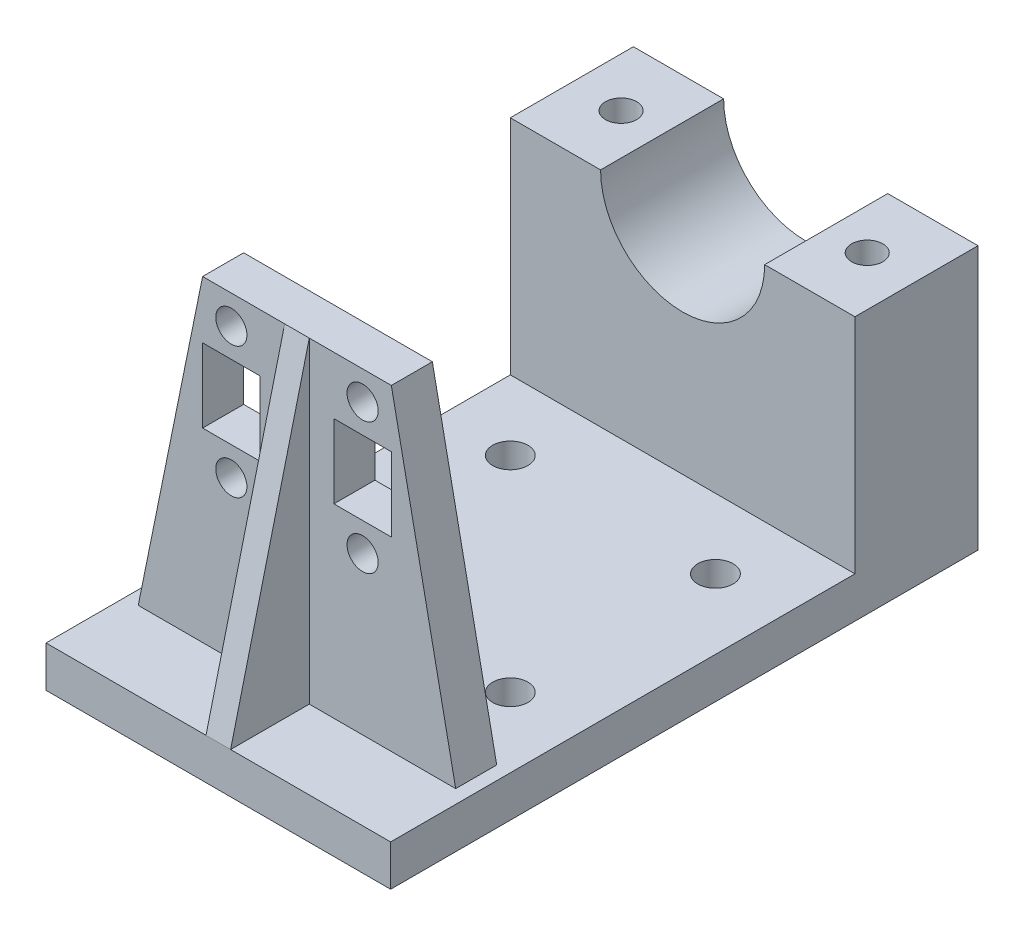
from build123d import *

# Parameters (mm, degrees)
MOTOR_MOUNT_SOLID_DEPTH              = 7.5
ENCODER_DISTANCE_SKETCH_W            = 50
ENCODER_DISTANCE_SKETCH_H            = 57
ENCODER_DISTANCE_SOLID_DEPTH         = 5
ENCODER_MOUNT_SKETCH_R               = 1.9
ENCODER_MOUNT_SKETCH_W               = 7
ENCODER_MOUNT_SKETCH_H               = 9
ENCODER_MOUNT_SOLID_DEPTH            = 5
MOTOR_CLAMP_MOUNTING_HOLES_SKETCH_R  = 1.9
MOTOR_CLAMP_MOUNTING_HOLES_CUT_DEPTH = 16
GUSSET_PLATE_SKETCH_W                = 50
GUSSET_PLATE_SKETCH_H                = 5
GUSSET_PLATE_SOLID_DEPTH             = 16.5
GUSSET_SOLID_DEPTH                   = 1.5
MOUNTING_PLATE_SKETCH_W              = 50
MOUNTING_PLATE_SKETCH_H              = 92
MOUNTING_PLATE_SKETCH_R              = 2.65
MOUNTING_PLATE_SOLID_DEPTH           = 5
MOUNTING_HOLES_CUT_DEPTH             = 101.440280764
MOUNTING_HOLES_CUT_DEPTH_BACK        = 101.440280764
MOUNTING_HOLE_SKETCH_R               = 2.65
MOUNTING_PLATE_TRIM_SKETCH_W         = 50
MOUNTING_PLATE_TRIM_SKETCH_H         = 13.5
MOUNTING_PLATE_TRIM_SKETCH_H_2       = 42
MOUNTING_PLATE_TRIM_SKETCH_W_2       = 23.5
MOUNTING_PLATE_TRIM_SKETCH_H_3       = 16.5
MOUNTING_PLATE_TRIM_CUT_DEPTH        = 2
CUT_EXTRUDE1_DEPTH                   = 102.917859083
CUT_EXTRUDE1_DEPTH_BACK              = 102.917859083
SKETCH2_W                            = 50
SKETCH2_H                            = 120
SKETCH2_W_2                          = 42
SKETCH2_H_2                          = 54.272597004
SKETCH3_W                            = 42
SKETCH3_H                            = 71.586450004
BOSS_EXTRUDE1_DEPTH                  = 5
CUT_EXTRUDE2_DEPTH                   = 78.722819275
CUT_EXTRUDE2_DEPTH_BACK              = 78.722819275
SKETCH4_R                            = 2.15


with BuildPart() as part:
    # Mouting Mount Sketch → Motor Mount Solid (new, symmetric)
    with BuildSketch(Plane.XY):
        with BuildLine():
            Line((-25, -55), (25, -55))
            Line((25, -55), (25, 0))
            Line((25, 0), (10, 0))
            ThreePointArc((10, 0), (0, -10), (-10, 0))
            Line((-10, 0), (-25, 0))
            Line((-25, 0), (-25, -55))
        make_face()
    extrude(amount=MOTOR_MOUNT_SOLID_DEPTH, both=True)

    # Encoder Distance Sketch → Encoder Distance Solid (add)
    with BuildSketch(Plane.XZ.offset(55)):
        with Locations((0, 21)):
            Rectangle(ENCODER_DISTANCE_SKETCH_W, ENCODER_DISTANCE_SKETCH_H)
    extrude(amount=ENCODER_DISTANCE_SOLID_DEPTH)

    # Encoder Mount Sketch → Encoder Mount Solid (add)
    with BuildSketch(Plane.XY.offset(49.5)):
        Polygon((-25, -60), (-25, -55), (-11.5, 11.5), (11.5, 11.5), (25, -55), (25, -60), align=None)
        with Locations((-8, 8)):
            Circle(ENCODER_MOUNT_SKETCH_R, mode=Mode.SUBTRACT)
        with Locations((8, 8)):
            Circle(ENCODER_MOUNT_SKETCH_R, mode=Mode.SUBTRACT)
        with Locations((-8, -8)):
            Circle(ENCODER_MOUNT_SKETCH_R, mode=Mode.SUBTRACT)
        with Locations((8, -8)):
            Circle(ENCODER_MOUNT_SKETCH_R, mode=Mode.SUBTRACT)
        with Locations((-8, 0)):
            Rectangle(ENCODER_MOUNT_SKETCH_W, ENCODER_MOUNT_SKETCH_H, mode=Mode.SUBTRACT)
        with Locations((8, 0)):
            Rectangle(ENCODER_MOUNT_SKETCH_W, ENCODER_MOUNT_SKETCH_H, mode=Mode.SUBTRACT)
    extrude(amount=ENCODER_MOUNT_SOLID_DEPTH)

    # Motor Clamp Mounting Holes Sketch → Motor Clamp Mounting Holes Cut (cut)
    with BuildSketch(Plane(origin=(0, 0, 0), x_dir=(1, 0, 0), z_dir=(0, 1, 0))):
        with Locations(Location((-15, 0, 0), (0, 0, 180))):
            Circle(MOTOR_CLAMP_MOUNTING_HOLES_SKETCH_R)
        with Locations(Location((15, 0, 0), (0, 0, 180))):
            Circle(MOTOR_CLAMP_MOUNTING_HOLES_SKETCH_R)
    extrude(amount=-MOTOR_CLAMP_MOUNTING_HOLES_CUT_DEPTH, mode=Mode.SUBTRACT)

    # Gusset Plate Sketch → Gusset Plate Solid (add)
    with BuildSketch(Plane.XY.offset(54.5)):
        with Locations((0, -57.5)):
            Rectangle(GUSSET_PLATE_SKETCH_W, GUSSET_PLATE_SKETCH_H)
    extrude(amount=GUSSET_PLATE_SOLID_DEPTH)

    # Gusset Sketch → Gusset Solid (add, symmetric)
    with BuildSketch(Plane(origin=(0, 0, 0), x_dir=(0, 0, -1), z_dir=(1, 0, 0))):
        Polygon((-54.5, 11.5), (-71, -55), (-54.5, -55), align=None)
    extrude(amount=GUSSET_SOLID_DEPTH, both=True)

    # Mounting Plate Sketch → Mounting Plate Solid (add)
    with BuildSketch(Plane(origin=(0, -55, 0), x_dir=(1, 0, 0), z_dir=(0, 1, 0))):
        with Locations((0, -25)):
            Rectangle(MOUNTING_PLATE_SKETCH_W, MOUNTING_PLATE_SKETCH_H)
        with Locations((-19, -65)):
            Circle(MOUNTING_PLATE_SKETCH_R, mode=Mode.SUBTRACT)
        with Locations((19, -65)):
            Circle(MOUNTING_PLATE_SKETCH_R, mode=Mode.SUBTRACT)
        with Locations(Location((-19, 15, 0), (0, 0, 270))):
            Circle(MOUNTING_PLATE_SKETCH_R, mode=Mode.SUBTRACT)
        with Locations(Location((19, 15, 0), (0, 0, 270))):
            Circle(MOUNTING_PLATE_SKETCH_R, mode=Mode.SUBTRACT)
    extrude(amount=-MOUNTING_PLATE_SOLID_DEPTH)

    # Mounting Hole Sketch → Mounting Holes Cut (cut, two sides: drawn at the far end of the back side and taken through both)
    with BuildSketch(Plane(origin=(0, -55, 0), x_dir=(1, 0, 0), z_dir=(0, 1, 0)).offset(-MOUNTING_HOLES_CUT_DEPTH_BACK)):
        with Locations(Location((-19, 15, 0), (0, 0, 270))):
            Circle(MOUNTING_HOLE_SKETCH_R)
        with Locations(Location((19, 15, 0), (0, 0, 270))):
            Circle(MOUNTING_HOLE_SKETCH_R)
        with Locations(Location((19, -65, 0), (0, 0, 90))):
            Circle(MOUNTING_HOLE_SKETCH_R)
        with Locations(Location((-19, -65, 0), (0, 0, 90))):
            Circle(MOUNTING_HOLE_SKETCH_R)
    extrude(amount=MOUNTING_HOLES_CUT_DEPTH + MOUNTING_HOLES_CUT_DEPTH_BACK, mode=Mode.SUBTRACT)

    # Mounting Plate Trim Sketch → Mounting Plate Trim Cut (cut)
    with BuildSketch(Plane(origin=(0, -55, 0), x_dir=(1, 0, 0), z_dir=(0, 1, 0))):
        with Locations((0, 14.25)):
            Rectangle(MOUNTING_PLATE_TRIM_SKETCH_W, MOUNTING_PLATE_TRIM_SKETCH_H)
        with Locations((0, -28.5)):
            Rectangle(MOUNTING_PLATE_TRIM_SKETCH_W, MOUNTING_PLATE_TRIM_SKETCH_H_2)
        with Locations((13.25, -62.75)):
            Rectangle(MOUNTING_PLATE_TRIM_SKETCH_W_2, MOUNTING_PLATE_TRIM_SKETCH_H_3)
        with Locations((-13.25, -62.75)):
            Rectangle(MOUNTING_PLATE_TRIM_SKETCH_W_2, MOUNTING_PLATE_TRIM_SKETCH_H_3)
    extrude(amount=-MOUNTING_PLATE_TRIM_CUT_DEPTH, mode=Mode.SUBTRACT)

    # Sketch2 → Cut-Extrude1 (cut, two sides: drawn at the far end of the back side and taken through both)
    with BuildSketch(Plane(origin=(0, 0, -7.5), x_dir=(-1, 0, 0), z_dir=(0, 0, -1)).offset(-CUT_EXTRUDE1_DEPTH_BACK)):
        Rectangle(SKETCH2_W, SKETCH2_H)
        Rectangle(SKETCH2_W_2, SKETCH2_H_2, mode=Mode.SUBTRACT)
    extrude(amount=CUT_EXTRUDE1_DEPTH + CUT_EXTRUDE1_DEPTH_BACK, mode=Mode.SUBTRACT)


with BuildPart() as cut_extrude1_piece_1:
    # of the separate pieces the step leaves, piece 1, a body of its own (cut_extrude1_pieces)
    add(part.part.solids().sort_by_distance((21, 0, 7.5))[0])



with BuildPart() as cut_extrude1_piece_2:
    # of the separate pieces the step leaves, piece 2, a body of its own (cut_extrude1_pieces)
    add(part.part.solids().sort_by_distance((-1.5, -27.136298502, 54.5))[0])


with BuildPart() as cut_extrude1_piece_1_1:
    add(cut_extrude1_piece_1.part)

    add(cut_extrude1_piece_2.part)  # Boss-Extrude1 merges Cut-Extrude1 piece 2
    # Sketch3 → Boss-Extrude1 (add)
    with BuildSketch(Plane.XZ.offset(27.136298502)):
        with Locations((0, 28.293225002)):
            Rectangle(SKETCH3_W, SKETCH3_H)
    extrude(amount=BOSS_EXTRUDE1_DEPTH)

    # Sketch4 → Cut-Extrude2 (cut, two sides: drawn at the far end of the back side and taken through both)
    with BuildSketch(Plane(origin=(0, -27.136298502, 0), x_dir=(1, 0, 0), z_dir=(0, 1, 0)).offset(-CUT_EXTRUDE2_DEPTH_BACK)):
        with Locations(Location((-12.5, -16, 0), (0, 0, 270))):
            Circle(SKETCH4_R)
        with Locations(Location((12.5, -16, 0), (0, 0, 270))):
            Circle(SKETCH4_R)
        with Locations(Location((-12.5, -41, 0), (0, 0, 270))):
            Circle(SKETCH4_R)
        with Locations(Location((12.5, -41, 0), (0, 0, 270))):
            Circle(SKETCH4_R)
    extrude(amount=CUT_EXTRUDE2_DEPTH + CUT_EXTRUDE2_DEPTH_BACK, mode=Mode.SUBTRACT)


solid = cut_extrude1_piece_1_1.part
